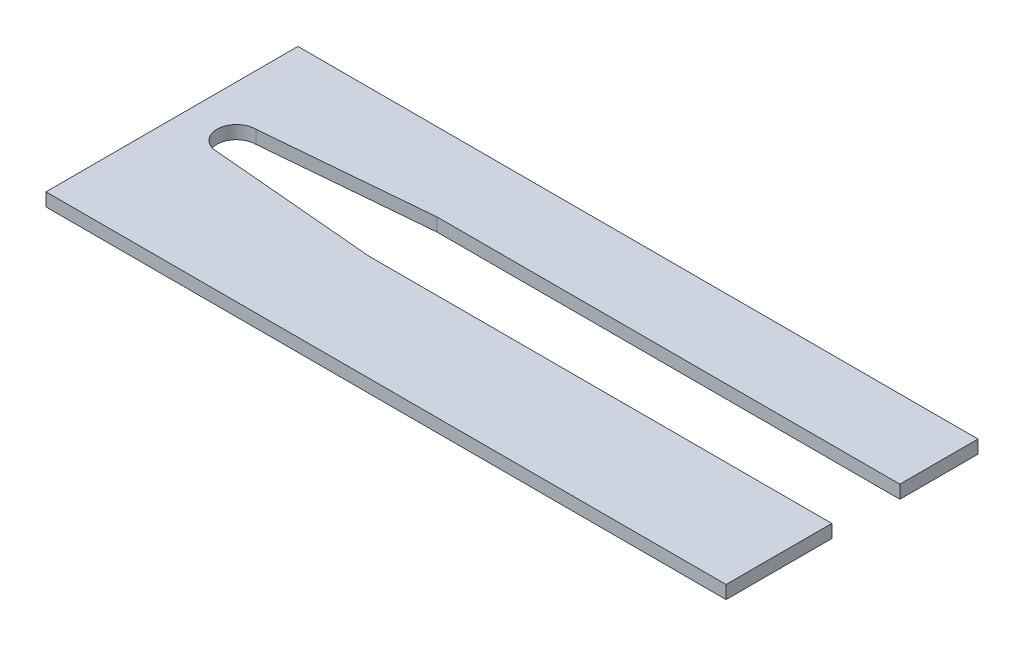
from build123d import *

# Parameters (mm, degrees)
SKETCH1_W           = 35
SKETCH1_H           = 12.964307825
BOSS_EXTRUDE1_DEPTH = 0.675
CUT_EXTRUDE1_DEPTH  = 0.68


with BuildPart() as part:
    # Sketch1 → Boss-Extrude1 (new body)
    with BuildSketch(Plane(origin=(0, 0, 0), x_dir=(1, 0, 0), z_dir=(0, 1, 0))):
        with Locations((19.821319384, 77.80811632)):
            Rectangle(SKETCH1_W, SKETCH1_H)
    extrude(amount=BOSS_EXTRUDE1_DEPTH)

    # Sketch2 → Cut-Extrude1 (cut)
    with BuildSketch(Plane(origin=(0, 0.675, 0), x_dir=(1, 0, 0), z_dir=(0, 1, 0))):
        with BuildLine():
            Line((13.502454123, 76.768011208), (37.321319384, 76.768011208))
            Line((37.321319384, 76.768011208), (37.321319384, 78.518011208))
            Line((37.321319384, 78.518011208), (37.321319384, 80.268011208))
            Line((37.321319384, 80.268011208), (13.502454123, 80.268011208))
            Line((13.502454123, 80.268011208), (4.929914896, 79.518011208))
            ThreePointArc((4.929914896, 79.518011208), (3.929914896, 78.518011208), (4.929914896, 77.518011208))
            Line((4.929914896, 77.518011208), (13.502454123, 76.768011208))
        make_face()
    extrude(amount=-CUT_EXTRUDE1_DEPTH, mode=Mode.SUBTRACT)


solid = part.part
